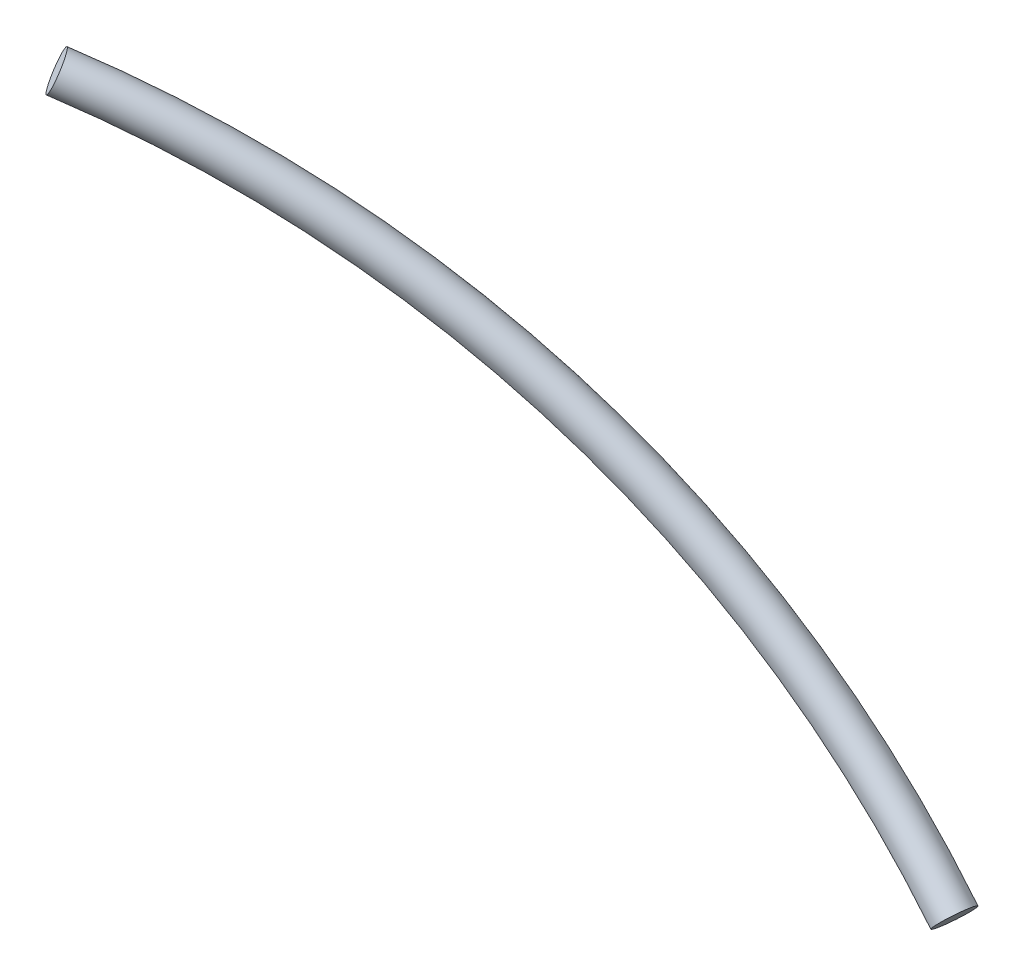
from build123d import *

# Parameters (mm, degrees)
SKETCH2_R = 50.8


with BuildPart() as part:
    # Sweep1: sweep along a path in Sketch1
    with BuildLine(Plane(origin=(-240.758193977, -278.04676483, -126.28756194), x_dir=(0.7852995035947753, -0.5636968128155838, -0.25602850012323247), z_dir=(-0.6191160550767517, -0.7150045999488047, -0.3247518012240277))) as sweep1_path:
        ThreePointArc((5353.367231163, -16005.73008558), (6548.186677501, -16211.045763483), (7736.870909103, -15972.764764489))
    # Sketch2 → Sweep1 (sweep)
    with BuildSketch(Plane(origin=(7787.056146516, -4073.312400842, -5877.271107558), x_dir=(-0.49259310753038127, 0.2576693394423084, -0.8312391604856731), z_dir=(0.7365563089241979, -0.3852834615044983, -0.5559149737820284))):
        with Locations((12261.973158036, 4781.708963444)):
            Circle(SKETCH2_R)
    sweep(path=sweep1_path.line)


solid = part.part
